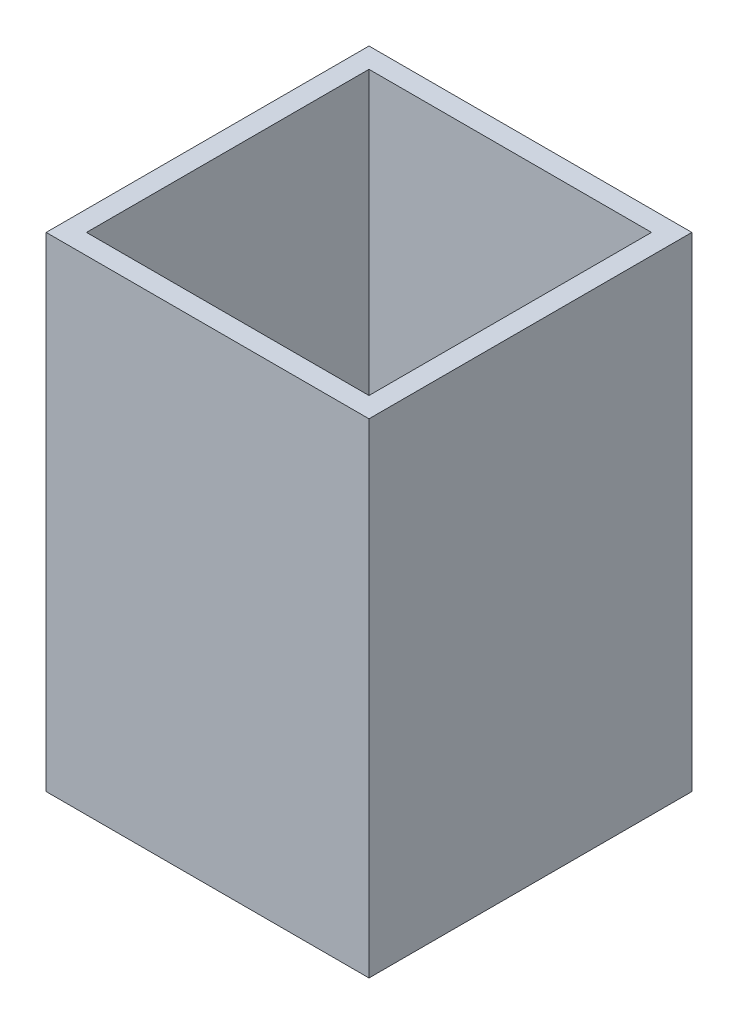
from build123d import *

# Parameters (mm, degrees)
SKETCH1_W           = 50.8
SKETCH1_H           = 50.8
BOSS_EXTRUDE1_DEPTH = 76.2
SHELL1_T            = -3.175


with BuildPart() as part:
    # Sketch1 → Boss-Extrude1 (new body)
    with BuildSketch(Plane(origin=(0, 0, 0), x_dir=(1, 0, 0), z_dir=(0, 1, 0))):
        with Locations((64.927548208, 1.837470194)):
            Rectangle(SKETCH1_W, SKETCH1_H)
    extrude(amount=BOSS_EXTRUDE1_DEPTH)

    # Shell1
    shell1_openings = [part.faces().sort_by_distance(p)[0] for p in [
        (64.927548208, 76.2, -1.837470194),
        (64.927548208, 0, -1.837470194),
    ]]
    offset(amount=SHELL1_T, openings=shell1_openings, kind=Kind.INTERSECTION)


solid = part.part
